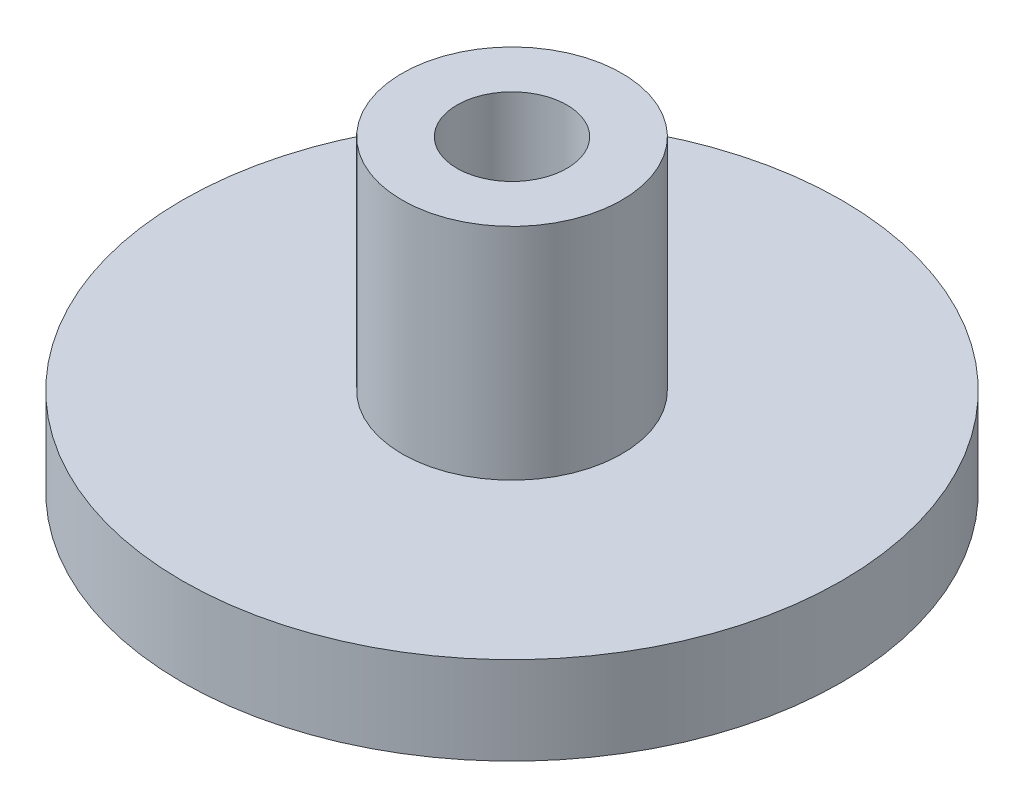
from build123d import *

# Parameters (mm, degrees)
SKETCH1_R           = 15
SKETCH1_R_2         = 2.5
BOSS_EXTRUDE1_DEPTH = 4
SKETCH2_R           = 5
SKETCH2_R_2         = 2.5
BOSS_EXTRUDE2_DEPTH = 10


with BuildPart() as part:
    # Sketch1 → Boss-Extrude1 (new body)
    with BuildSketch(Plane(origin=(0, 0, 0), x_dir=(1, 0, 0), z_dir=(0, 1, 0))):
        with Locations(Location((0, 0, 0), (0, 0, 270))):
            Circle(SKETCH1_R)
        with Locations(Location((0, 0, 0), (0, 0, 270))):
            Circle(SKETCH1_R_2, mode=Mode.SUBTRACT)
    extrude(amount=BOSS_EXTRUDE1_DEPTH)

    # Sketch2 → Boss-Extrude2 (add)
    with BuildSketch(Plane(origin=(0, 4, 0), x_dir=(1, 0, 0), z_dir=(0, 1, 0))):
        with Locations(Location((0, 0, 0), (0, 0, 270))):
            Circle(SKETCH2_R)
        with Locations(Location((0, 0, 0), (0, 0, 270))):
            Circle(SKETCH2_R_2, mode=Mode.SUBTRACT)
    extrude(amount=BOSS_EXTRUDE2_DEPTH)


solid = part.part
